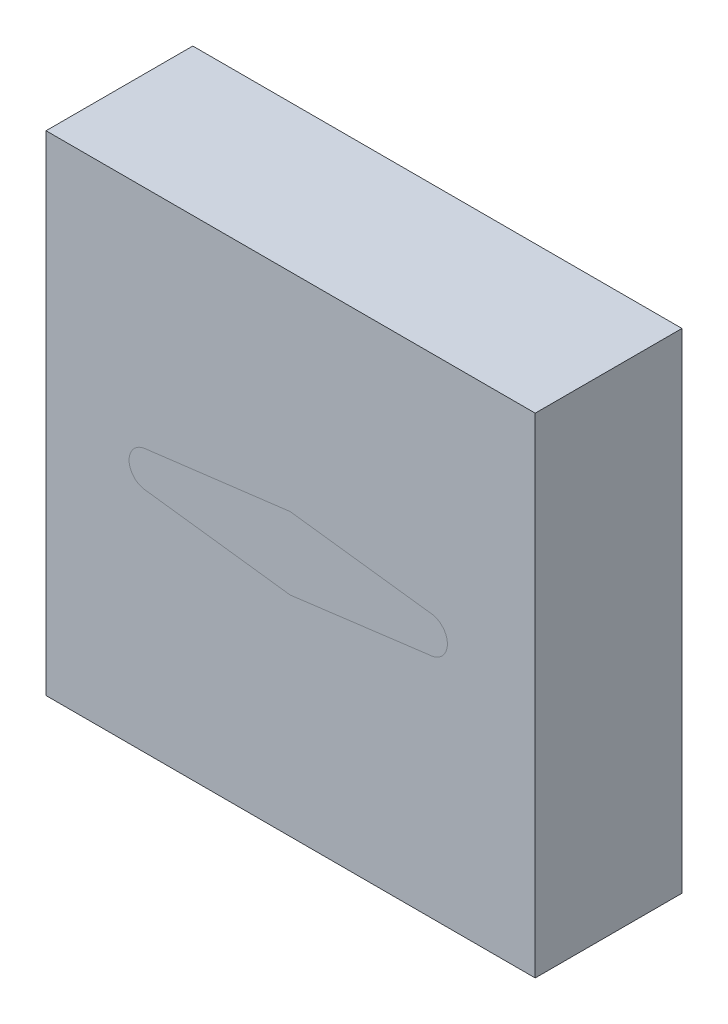
from build123d import *

# Parameters (mm, degrees)
SKETCH_1_W          = 50
SKETCH_1_H          = 50
EXTRUDE_1_DEPTH     = 15
CUT_EXTRUDE_1_REACH = 40.406
EXTRUDE_3_DEPTH     = 10


with BuildPart() as part:
    # 草图1 → 凸台-拉伸1 (new body)
    with BuildSketch(Plane.XY):
        Rectangle(SKETCH_1_W, SKETCH_1_H)
    extrude(amount=EXTRUDE_1_DEPTH)

    # 草图2 → 切除-拉伸1 (cut, up to next)
    with BuildSketch(Plane.XY.offset(15), mode=Mode.PRIVATE) as cut_extrude_1_sk1:
        with BuildLine():
            Line((-14.785952776, -1.74496373), (-0.047775551, -3.622183986))
            Line((-0.047775551, -3.622183986), (14.163975636, -1.811427055))
            ThreePointArc((14.163975636, -1.811427055), (16.026917864, 0.091112846), (14.140474077, 1.970352496))
            Line((14.140474077, 1.970352496), (-0.047775551, 3.765510639))
            Line((-0.047775551, 3.765510639), (-14.821170511, 1.926562958))
            ThreePointArc((-14.821170511, 1.926562958), (-16.512366288, 0.07440855), (-14.785952776, -1.74496373))
        make_face()
    cut_extrude_1_tool1 = extrude(cut_extrude_1_sk1.sketch, amount=-CUT_EXTRUDE_1_REACH, mode=Mode.PRIVATE) & part.part
    add(cut_extrude_1_tool1.solids().sort_by_distance((-0.185871, 0.078308, 15))[0], mode=Mode.SUBTRACT)


with BuildPart() as body_2:
    # 草图3 → 凸台-拉伸3 (new body)
    with BuildSketch(Plane.XY.offset(15)):
        with BuildLine():
            Line((14.140474077, 1.970352496), (-0.047775551, 3.765510639))
            Line((-0.047775551, 3.765510639), (-14.821170511, 1.926562958))
            ThreePointArc((-14.821170511, 1.926562958), (-16.512366288, 0.07440855), (-14.785952776, -1.74496373))
            Line((-14.785952776, -1.74496373), (-0.047775551, -3.622183986))
            Line((-0.047775551, -3.622183986), (14.163975636, -1.811427055))
            ThreePointArc((14.163975636, -1.811427055), (16.026917864, 0.091112846), (14.140474077, 1.970352496))
        make_face()
    extrude(amount=-EXTRUDE_3_DEPTH)


solid = Compound([part.part, body_2.part])
